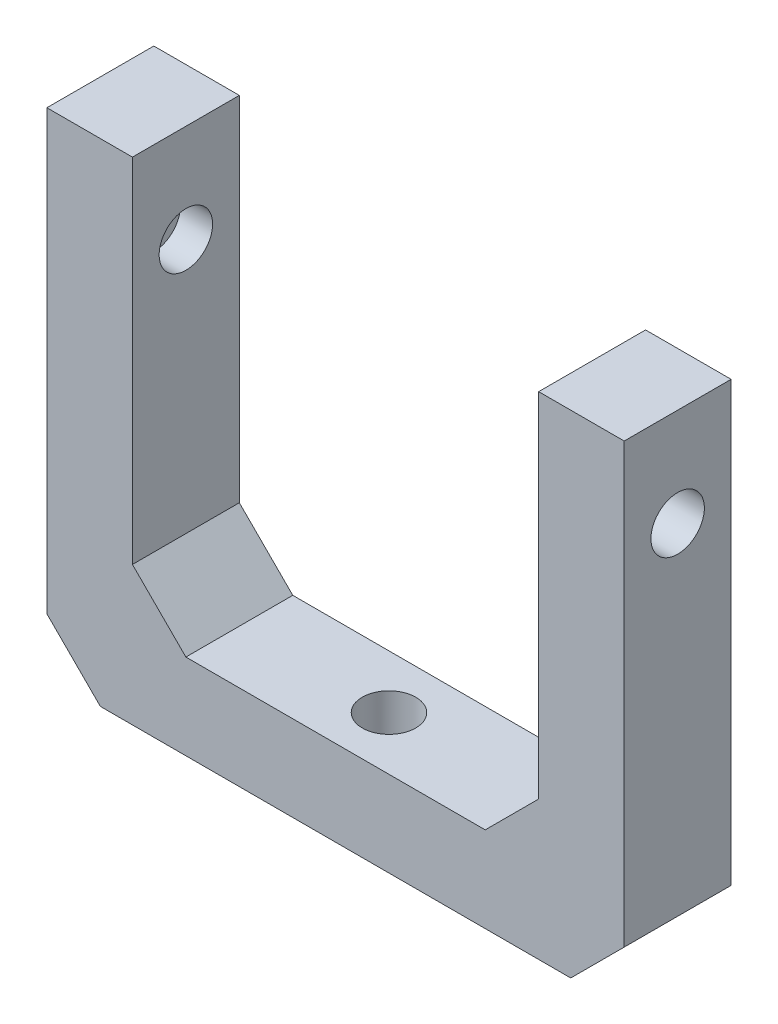
from build123d import *

# Parameters (mm, degrees)
BOSS_EXTRUDE1_DEPTH            = 10
SKETCH2_R                      = 2.5
CUT_EXTRUDE1_DEPTH             = 3
CUT_EXTRUDE1_DIRECTION_2_REACH = 62.498
CUT_EXTRUDE2_DEPTH             = 3
CUT_EXTRUDE3_REACH             = 56.268
SKETCH4_R                      = 2.5
SKETCH5_W                      = 38
SKETCH5_H                      = 7
CUT_EXTRUDE4_DEPTH             = 4


with BuildPart() as part:
    # Sketch1 → Boss-Extrude1 (new body)
    with BuildSketch(Plane.XY):
        Polygon((-27, 38), (-19, 38), (-19, 5), (-14, 0), (14, 0), (19, 5), (19, 38), (27, 38), (27, -3), (22, -8), (-22, -8), (-27, -3), align=None)
    extrude(amount=BOSS_EXTRUDE1_DEPTH)

    # Sketch2 → Cut-Extrude1 (cut)
    with BuildSketch(Plane(origin=(-19, 0, 0), x_dir=(0, 0, -1), z_dir=(1, 0, 0))):
        with Locations(Location((-5, 28.83, 0), (0, 0, 90))):
            Circle(SKETCH2_R)
    extrude(amount=-CUT_EXTRUDE1_DEPTH, mode=Mode.SUBTRACT)

    # Sketch2 → Cut-Extrude1 direction 2 (cut, up to next)
    with BuildSketch(Plane(origin=(-19, 0, 0), x_dir=(0, 0, -1), z_dir=(1, 0, 0)), mode=Mode.PRIVATE) as cut_extrude1_direction_2_sk1:
        with Locations(Location((-5, 28.83, 0), (0, 0, 90))):
            Circle(SKETCH2_R)
    cut_extrude1_direction_2_tool1 = extrude(cut_extrude1_direction_2_sk1.sketch, amount=CUT_EXTRUDE1_DIRECTION_2_REACH, mode=Mode.PRIVATE) & part.part
    add(cut_extrude1_direction_2_tool1.solids().sort_by_distance((-19, 28.83, 5))[0], mode=Mode.SUBTRACT)

    # Sketch3 → Cut-Extrude2 (cut)
    with BuildSketch(Plane.ZY.offset(-19)):
        with BuildLine():
            Line((8.5, 28.503575447), (8.5, 16.503575447))
            ThreePointArc((8.5, 16.503575447), (5, 13.003575447), (1.5, 16.503575447))
            Line((1.5, 16.503575447), (1.5, 28.503575447))
            ThreePointArc((1.5, 28.503575447), (5, 32.003575447), (8.5, 28.503575447))
        make_face()
    extrude(amount=-CUT_EXTRUDE2_DEPTH, mode=Mode.SUBTRACT)

    # Sketch4 → Cut-Extrude3 (cut, up to next)
    with BuildSketch(Plane.XZ.offset(8), mode=Mode.PRIVATE) as cut_extrude3_sk1:
        with Locations((0, 5)):
            Circle(SKETCH4_R)
    cut_extrude3_tool1 = extrude(cut_extrude3_sk1.sketch, amount=-CUT_EXTRUDE3_REACH, mode=Mode.PRIVATE) & part.part
    add(cut_extrude3_tool1.solids().sort_by_distance((0, -8, 5))[0], mode=Mode.SUBTRACT)

    # Sketch5 → Cut-Extrude4 (cut)
    with BuildSketch(Plane.XZ.offset(8)):
        with Locations((0, 5)):
            Rectangle(SKETCH5_W, SKETCH5_H)
    extrude(amount=-CUT_EXTRUDE4_DEPTH, mode=Mode.SUBTRACT)


solid = part.part
